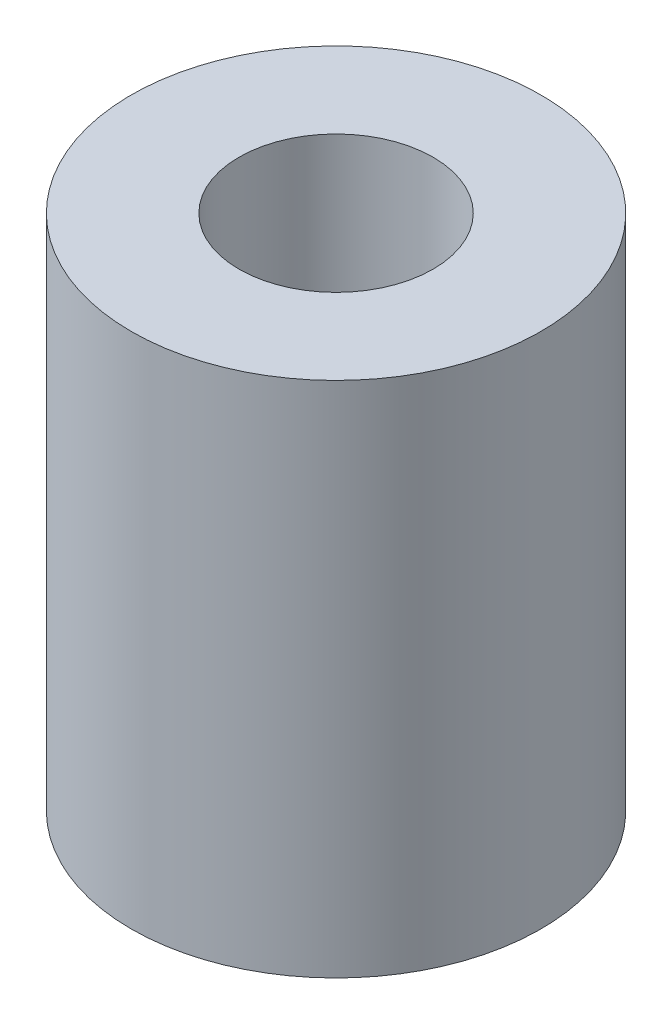
from build123d import *

# Parameters (mm, degrees)
SKETCH1_R           = 9.5
SKETCH1_R_2         = 3
BOSS_EXTRUDE1_DEPTH = 8
SKETCH2_R           = 9.5
SKETCH2_R_2         = 4.5
BOSS_EXTRUDE2_DEPTH = 16


with BuildPart() as part:
    # Sketch1 → Boss-Extrude1 (new body)
    with BuildSketch(Plane(origin=(0, 0, 0), x_dir=(1, 0, 0), z_dir=(0, 1, 0))):
        with Locations(Location((0, 0, 0), (0, 0, 270))):
            Circle(SKETCH1_R)
        with Locations(Location((0, 0, 0), (0, 0, 270))):
            Circle(SKETCH1_R_2, mode=Mode.SUBTRACT)
    extrude(amount=BOSS_EXTRUDE1_DEPTH)

    # Sketch2 → Boss-Extrude2 (add)
    with BuildSketch(Plane(origin=(0, 8, 0), x_dir=(1, 0, 0), z_dir=(0, 1, 0))):
        with Locations(Location((0, 0, 0), (0, 0, 270))):
            Circle(SKETCH2_R)
        with Locations(Location((0, 0, 0), (0, 0, 270))):
            Circle(SKETCH2_R_2, mode=Mode.SUBTRACT)
    extrude(amount=BOSS_EXTRUDE2_DEPTH)


solid = part.part
